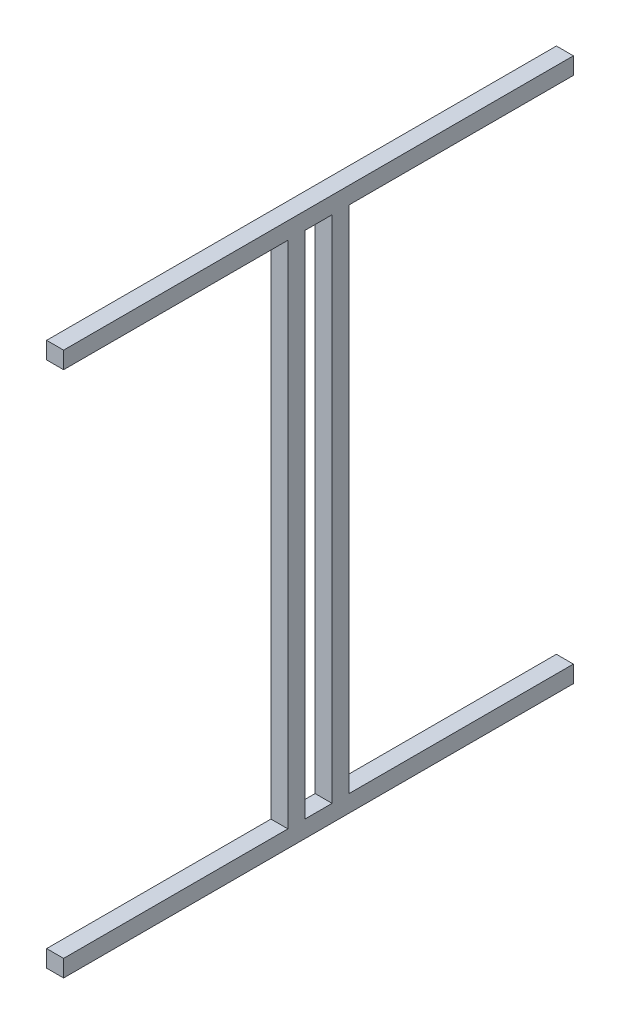
from build123d import *

# Parameters (mm, degrees)
SKETCH1_W           = 32
SKETCH1_H           = 600
BOSS_EXTRUDE1_DEPTH = 20


with BuildPart() as part:
    # Sketch1 → Boss-Extrude1 (new body)
    with BuildSketch(Plane(origin=(0, 0, 0), x_dir=(0, 0, -1), z_dir=(1, 0, 0))):
        Polygon((0, -500), (-600, -500), (-600, -520), (-336, -520), (-336, -1120), (-600, -1120), (-600, -1140), (0, -1140), (0, -1120), (-264, -1120), (-264, -520), (0, -520), align=None)
        with Locations((-300, -820)):
            Rectangle(SKETCH1_W, SKETCH1_H, mode=Mode.SUBTRACT)
    extrude(amount=BOSS_EXTRUDE1_DEPTH)


solid = part.part
